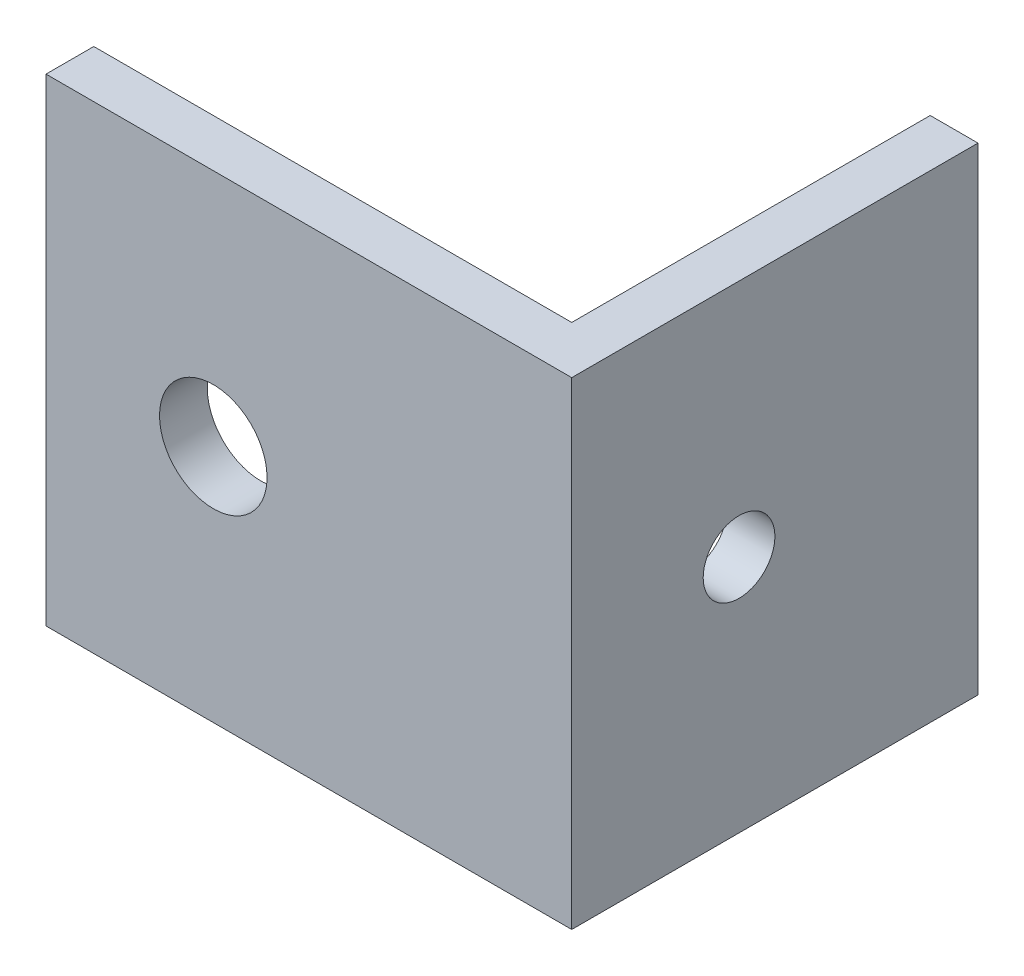
from build123d import *

# Parameters (mm, degrees)
BOSS_EXTRUDE1_DEPTH = 20
SKETCH3_R           = 2.25
CUT_EXTRUDE1_DEPTH  = 33.015621187
SKETCH4_R           = 1.5
CUT_EXTRUDE2_DEPTH  = 33.015621187


with BuildPart() as part:
    # Sketch2 → Boss-Extrude1 (new body)
    with BuildSketch(Plane(origin=(0, 0, 0), x_dir=(1, 0, 0), z_dir=(0, 1, 0))):
        Polygon((-20, 0), (0, 0), (0, 15), (2, 15), (2, -2), (-20, -2), align=None)
    extrude(amount=BOSS_EXTRUDE1_DEPTH)

    # Sketch3 → Cut-Extrude1 (cut, through all)
    with BuildSketch(Plane(origin=(0, 0, 0), x_dir=(-1, 0, 0), z_dir=(0, 0, -1))):
        with Locations((13, 10)):
            Circle(SKETCH3_R)
    extrude(amount=-CUT_EXTRUDE1_DEPTH, mode=Mode.SUBTRACT)

    # Sketch4 → Cut-Extrude2 (cut, through all)
    with BuildSketch(Plane.ZY):
        with Locations((-5, 10)):
            Circle(SKETCH4_R)
    extrude(amount=-CUT_EXTRUDE2_DEPTH, mode=Mode.SUBTRACT)


solid = part.part
